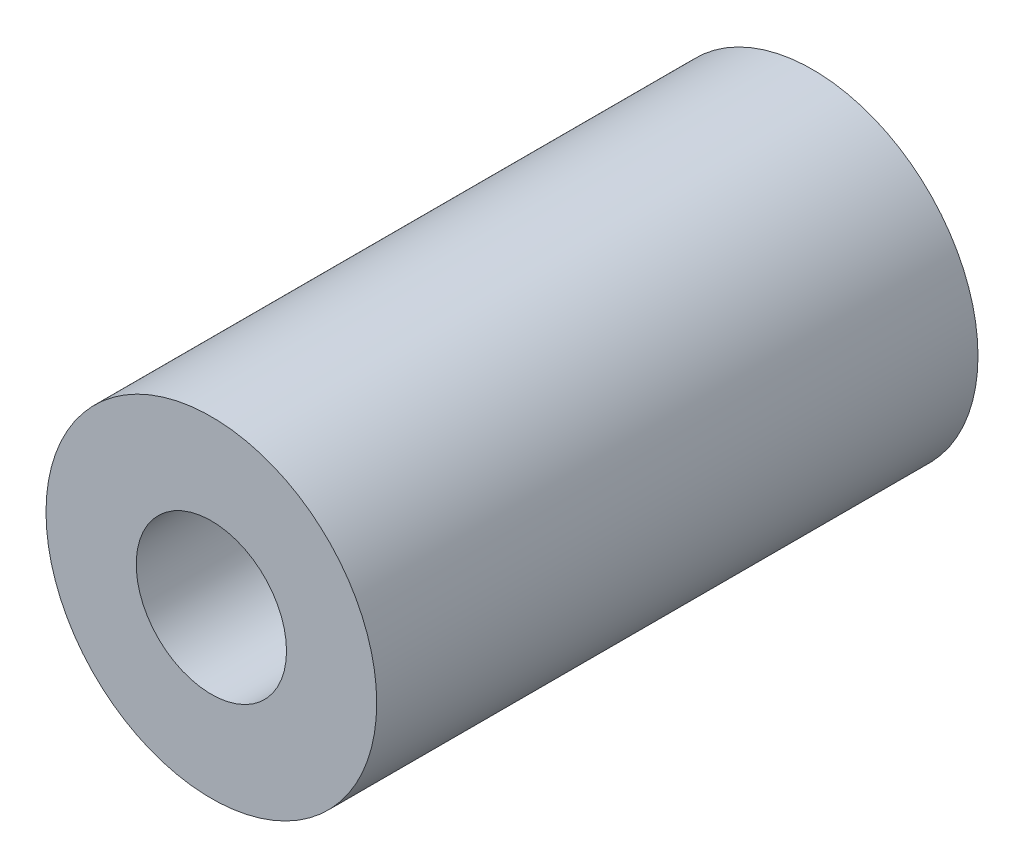
from build123d import *

# Parameters (mm, degrees)
SKETCH1_R           = 22
SKETCH1_R_2         = 10
BOSS_EXTRUDE1_DEPTH = 80


with BuildPart() as part:
    # Sketch1 → Boss-Extrude1 (new body)
    with BuildSketch(Plane.XY):
        Circle(SKETCH1_R)
        Circle(SKETCH1_R_2, mode=Mode.SUBTRACT)
    extrude(amount=BOSS_EXTRUDE1_DEPTH)


solid = part.part
